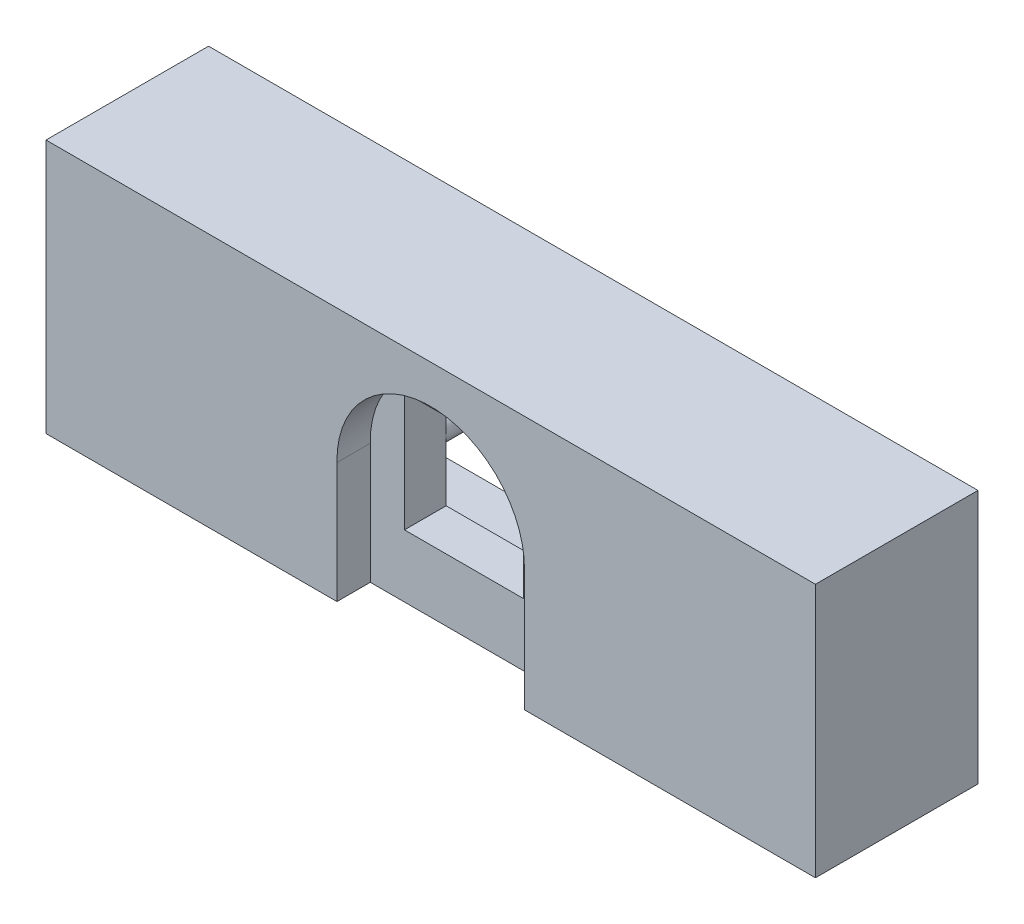
from build123d import *

# Parameters (mm, degrees)
SKETCH1_W                       = 24.3
SKETCH1_H                       = 24.3
SKETCH1_W_2                     = 14.3
SKETCH1_H_2                     = 14.3
BOSS_EXTRUDE1_DEPTH             = 4
SKETCH3_R                       = 1.5
BOSS_EXTRUDE4_DEPTH             = 4
BOSS_EXTRUDE5_DEPTH             = 4
BOSS_EXTRUDE6_REACH             = 23.355
BOSS_EXTRUDE6_DIRECTION_2_REACH = 23.355
CUT_EXTRUDE1_DEPTH              = 11
SKETCH7_W                       = 24.3
SKETCH7_H                       = 23.3
SKETCH7_W_2                     = 14.3
SKETCH7_H_2                     = 14.3
BOSS_EXTRUDE8_DEPTH             = 1
BOSS_EXTRUDE9_DEPTH             = 1.5
BOSS_EXTRUDE10_DEPTH            = 26.5
BOSS_EXTRUDE11_DEPTH            = 2
BOSS_EXTRUDE12_DEPTH            = 2
SKETCH12_R                      = 1.6
CUT_EXTRUDE2_DEPTH              = 2


with BuildPart() as part:
    # Sketch1 → Boss-Extrude1 (new body)
    with BuildSketch(Plane.XY):
        Rectangle(SKETCH1_W, SKETCH1_H)
        Rectangle(SKETCH1_W_2, SKETCH1_H_2, mode=Mode.SUBTRACT)
    extrude(amount=BOSS_EXTRUDE1_DEPTH)

    # Sketch3 → Boss-Extrude4 (add)
    with BuildSketch(Plane(origin=(0, 0, 0), x_dir=(-1, 0, 0), z_dir=(0, 0, -1))):
        with Locations(Location((8.75, 0, 0), (0, 0, 180))):
            Circle(SKETCH3_R)
        with Locations(Location((-8.75, 0, 0), (0, 0, 180))):
            Circle(SKETCH3_R)
    extrude(amount=BOSS_EXTRUDE4_DEPTH)

    # Sketch4 → Boss-Extrude5 (add)
    with BuildSketch(Plane.XY.offset(4)):
        with BuildLine():
            Line((11.248190336, -0.201777492), (11.248190336, -11.15))
            Line((11.248190336, -11.15), (14.15, -11.15))
            Line((14.15, -11.15), (14.15, 13.85))
            Line((14.15, 13.85), (-14.15, 13.85))
            Line((-14.15, 13.85), (-14.15, -11.15))
            Line((-14.15, -11.15), (-11.248190336, -11.15))
            Line((-11.248190336, -11.15), (-11.248190336, -0.201777492))
            ThreePointArc((-11.248190336, -0.201777492), (0, 11.25), (11.248190336, -0.201777492))
        make_face()
    extrude(amount=BOSS_EXTRUDE5_DEPTH)

    # Boss-Extrude6: up to this face of the body (flat: up to its plane)
    boss_extrude6_end = Plane(part.part.faces().sort_by_distance((0, 12.15, 2))[0])
    # Sketch5 → Boss-Extrude6 (add, up to the picked face)
    with BuildSketch(Plane(origin=(0, 0, 0), x_dir=(1, 0, 0), z_dir=(0, 1, 0)), mode=Mode.PRIVATE) as boss_extrude6_sk1:
        Polygon((-12.15, 0), (-14.15, -4), (-12.15, -4), align=None)
    boss_extrude6_tool1 = split(extrude(boss_extrude6_sk1.sketch, amount=BOSS_EXTRUDE6_REACH, mode=Mode.PRIVATE), bisect_by=boss_extrude6_end, keep=Keep.BOTH, mode=Mode.PRIVATE)
    # Sketch5 → Boss-Extrude6 (add, up to the picked face)
    with BuildSketch(Plane(origin=(0, 0, 0), x_dir=(1, 0, 0), z_dir=(0, 1, 0)), mode=Mode.PRIVATE) as boss_extrude6_sk2:
        Polygon((12.15, 0), (12.15, -4), (14.15, -4), align=None)
    boss_extrude6_tool2 = split(extrude(boss_extrude6_sk2.sketch, amount=BOSS_EXTRUDE6_REACH, mode=Mode.PRIVATE), bisect_by=boss_extrude6_end, keep=Keep.BOTH, mode=Mode.PRIVATE)
    add(boss_extrude6_tool1.solids().sort_by(Axis((-12.816667, 0, 2.666667), (0, 1, 0)))[0])
    add(boss_extrude6_tool2.solids().sort_by(Axis((12.816667, 0, 2.666667), (0, 1, 0)))[0])

    # Boss-Extrude6 direction 2: up to this face of the body (flat: up to its plane)
    boss_extrude6_direction_2_end = Plane(part.part.faces().sort_by_distance((12.699095168, -11.15, 6))[0])
    # Sketch5 → Boss-Extrude6 direction 2 (add, up to the picked face)
    with BuildSketch(Plane(origin=(0, 0, 0), x_dir=(1, 0, 0), z_dir=(0, 1, 0)), mode=Mode.PRIVATE) as boss_extrude6_direction_2_sk1:
        Polygon((-12.15, 0), (-14.15, -4), (-12.15, -4), align=None)
    boss_extrude6_direction_2_tool1 = split(extrude(boss_extrude6_direction_2_sk1.sketch, amount=-BOSS_EXTRUDE6_DIRECTION_2_REACH, mode=Mode.PRIVATE), bisect_by=boss_extrude6_direction_2_end, keep=Keep.BOTH, mode=Mode.PRIVATE)
    # Sketch5 → Boss-Extrude6 direction 2 (add, up to the picked face)
    with BuildSketch(Plane(origin=(0, 0, 0), x_dir=(1, 0, 0), z_dir=(0, 1, 0)), mode=Mode.PRIVATE) as boss_extrude6_direction_2_sk2:
        Polygon((12.15, 0), (12.15, -4), (14.15, -4), align=None)
    boss_extrude6_direction_2_tool2 = split(extrude(boss_extrude6_direction_2_sk2.sketch, amount=-BOSS_EXTRUDE6_DIRECTION_2_REACH, mode=Mode.PRIVATE), bisect_by=boss_extrude6_direction_2_end, keep=Keep.BOTH, mode=Mode.PRIVATE)
    add(boss_extrude6_direction_2_tool1.solids().sort_by(Axis((-12.816667, 0, 2.666667), (0, -1, 0)))[0])
    add(boss_extrude6_direction_2_tool2.solids().sort_by(Axis((12.816667, 0, 2.666667), (0, -1, 0)))[0])

    # Sketch6 → Cut-Extrude1 (cut)
    with BuildSketch(Plane.XY.offset(4)):
        Polygon((-14.15, -11.15), (-17.465023318, -11.15), (-17.465023318, -14.474968539), (16.848397365, -14.474968539), (16.848397365, -10.738940706), (14.15, -11.15), align=None)
    extrude(amount=-CUT_EXTRUDE1_DEPTH, mode=Mode.SUBTRACT)

    # Sketch7 → Boss-Extrude8 (add)
    with BuildSketch(Plane(origin=(0, 0, 0), x_dir=(-1, 0, 0), z_dir=(0, 0, -1))):
        with Locations((0, 0.5)):
            Rectangle(SKETCH7_W, SKETCH7_H)
        Rectangle(SKETCH7_W_2, SKETCH7_H_2, mode=Mode.SUBTRACT)
    extrude(amount=BOSS_EXTRUDE8_DEPTH)

    # Sketch8 → Boss-Extrude9 (add)
    with BuildSketch(Plane.XZ.offset(11.15)):
        Polygon((-14.15, 4), (-12.15, 0), (-12.15, -1), (12.15, -1), (12.15, 0), (14.15, 4), (14.15, 8), (11.248190336, 8), (11.248190336, 4), (-11.248190336, 4), (-11.248190336, 8), (-14.15, 8), align=None)
    extrude(amount=BOSS_EXTRUDE9_DEPTH)

    # Sketch9 → Boss-Extrude10 (add)
    with BuildSketch(Plane.XZ.offset(12.65)):
        Polygon((-42.15, 4), (-42.15, -11.5), (-46.15, -11.5), (-46.15, 8), (-14.15, 8), (-14.15, 4), align=None)
        Polygon((42.15, 4), (42.15, -11.5), (46.15, -11.5), (46.15, 8), (14.15, 8), (14.15, 4), align=None)
    extrude(amount=-BOSS_EXTRUDE10_DEPTH)

    # Sketch10 → Boss-Extrude11 (add)
    with BuildSketch(Plane(origin=(0, 13.85, 0), x_dir=(1, 0, 0), z_dir=(0, 1, 0))):
        Polygon((-42.15, 11.5), (-46.15, 11.5), (-46.15, -8), (46.15, -8), (46.15, 11.5), align=None)
    extrude(amount=BOSS_EXTRUDE11_DEPTH)

    # Sketch11 → Boss-Extrude12 (add)
    with BuildSketch(Plane.XZ.offset(12.65)):
        Polygon((-11.248190336, 8), (-46.15, 8), (-46.15, -11.5), (42.15, -11.5), (46.15, -11.5), (46.15, 8), (11.248190336, 8), (11.248190336, 4), (-11.248190336, 4), align=None)
    extrude(amount=BOSS_EXTRUDE12_DEPTH)

    # Sketch12 → Cut-Extrude2 (cut)
    with BuildSketch(Plane.XZ.offset(14.65)):
        with Locations((26.248190336, -7.5)):
            Circle(SKETCH12_R)
    extrude(amount=-CUT_EXTRUDE2_DEPTH, mode=Mode.SUBTRACT)


solid = part.part
